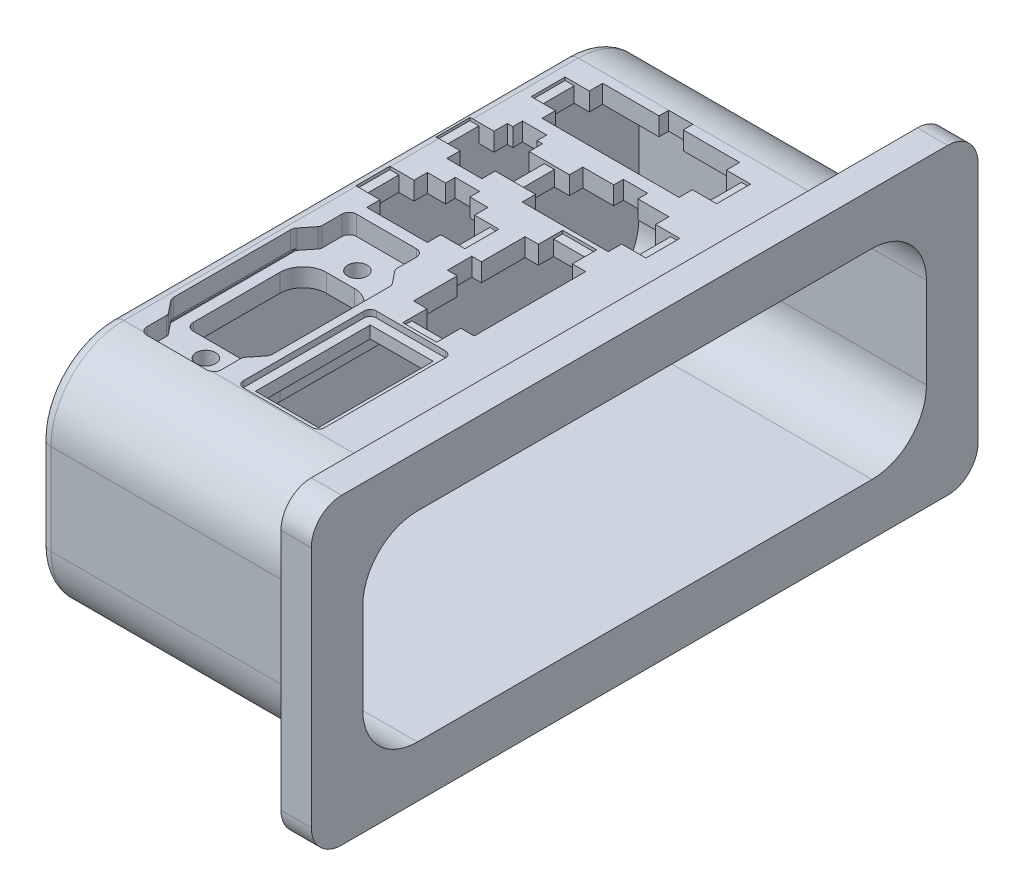
from build123d import *

# Parameters (mm, degrees)
BOSS_EXTRUDE1_DEPTH      = 10.45
BOSS_EXTRUDE2_DEPTH      = 5
CUT_EXTRUDE1_REACH       = 214.842
EXTRUDE_THIN1_DEPTH      = 35
EXTRUDE_THIN1_DEPTH_BACK = 15.45
BOSS_EXTRUDE4_DEPTH      = 3
FILLET1_R                = 2
CUT_EXTRUDE2_REACH       = 421.465
SKETCH16_W               = 30.6
SKETCH16_H               = 5.6
SKETCH16_W_2             = 34.65
SKETCH16_W_3             = 18
SKETCH16_W_4             = 5.6
SKETCH16_H_2             = 26.4
CUT_EXTRUDE3_DEPTH       = 0.5
CUT_EXTRUDE4_DEPTH       = 3
CUT_EXTRUDE5_DEPTH       = 1
SKETCH25_W               = 10.4
SKETCH25_H               = 18.95
CUT_EXTRUDE6_DEPTH       = 420.157757205
BOSS_EXTRUDE6_DEPTH      = 0.2
SKETCH28_R               = 1.6
BOSS_EXTRUDE7_DEPTH      = 3


with BuildPart() as part:
    # Sketch1 → Boss-Extrude1 (new body)
    with BuildSketch(Plane.ZY.offset(330.42)):
        with BuildLine():
            Line((-96.595, 35.5), (-96.595, 50.5))
            ThreePointArc((-96.595, 50.5), (-100.109718626, 58.985281374), (-108.595, 62.5))
            Line((-108.595, 62.5), (-183.595, 62.5))
            ThreePointArc((-183.595, 62.5), (-192.080281374, 58.985281374), (-195.595, 50.5))
            Line((-195.595, 50.5), (-195.595, 35.5))
            ThreePointArc((-195.595, 35.5), (-192.080281374, 27.014718626), (-183.595, 23.5))
            Line((-183.595, 23.5), (-108.595, 23.5))
            ThreePointArc((-108.595, 23.5), (-100.109718626, 27.014718626), (-96.595, 35.5))
        make_face()
    extrude(amount=-BOSS_EXTRUDE1_DEPTH)

    # Sketch2 → Boss-Extrude2 (add)
    with BuildSketch(Plane(origin=(-319.97, 0, 0), x_dir=(0, 0, -1), z_dir=(1, 0, 0))):
        with BuildLine():
            Line((51.095, 23), (51.095, 63))
            ThreePointArc((51.095, 63), (49.630533906, 66.535533906), (46.095, 68))
            Line((46.095, 68), (-53.905, 68))
            ThreePointArc((-53.905, 68), (-57.440533906, 66.535533906), (-58.905, 63))
            Line((-58.905, 63), (-58.905, 23))
            ThreePointArc((-58.905, 23), (-57.440533906, 19.464466094), (-53.905, 18))
            Line((-53.905, 18), (46.095, 18))
            ThreePointArc((46.095, 18), (49.630533906, 19.464466094), (51.095, 23))
        make_face()
        with BuildLine():
            Line((201.095, 23), (201.095, 63))
            ThreePointArc((201.095, 63), (199.630533906, 66.535533906), (196.095, 68))
            Line((196.095, 68), (96.095, 68))
            ThreePointArc((96.095, 68), (92.559466094, 66.535533906), (91.095, 63))
            Line((91.095, 63), (91.095, 23))
            ThreePointArc((91.095, 23), (92.559466094, 19.464466094), (96.095, 18))
            Line((96.095, 18), (196.095, 18))
            ThreePointArc((196.095, 18), (199.630533906, 19.464466094), (201.095, 23))
        make_face()
        with BuildLine():
            Line((-98.905, 23), (-98.905, 63))
            ThreePointArc((-98.905, 63), (-100.369466094, 66.535533906), (-103.905, 68))
            Line((-103.905, 68), (-203.905, 68))
            ThreePointArc((-203.905, 68), (-207.440533906, 66.535533906), (-208.905, 63))
            Line((-208.905, 63), (-208.905, 23))
            ThreePointArc((-208.905, 23), (-207.440533906, 19.464466094), (-203.905, 18))
            Line((-203.905, 18), (-103.905, 18))
            ThreePointArc((-103.905, 18), (-100.369466094, 19.464466094), (-98.905, 23))
        make_face()
    extrude(amount=BOSS_EXTRUDE2_DEPTH)


with BuildPart() as boss_extrude2_piece_1:
    # of the separate pieces the step leaves, piece 1, a body of its own (boss_extrude2_pieces)
    add(part.part.solids().sort_by_distance((-319.97, 23, -201.095))[0])

    # Sketch10 → Cut-Extrude1 (cut, up to next)
    with BuildSketch(Plane(origin=(-314.97, 0, 0), x_dir=(0, 0, -1), z_dir=(1, 0, 0)), mode=Mode.PRIVATE) as cut_extrude1_sk1:
        with BuildLine():
            Line((183.595, 62.5), (108.595, 62.5))
            ThreePointArc((108.595, 62.5), (100.109718626, 58.985281374), (96.595, 50.5))
            Line((96.595, 50.5), (96.595, 35.5))
            ThreePointArc((96.595, 35.5), (100.109718626, 27.014718626), (108.595, 23.5))
            Line((108.595, 23.5), (183.595, 23.5))
            ThreePointArc((183.595, 23.5), (192.080281374, 27.014718626), (195.595, 35.5))
            Line((195.595, 35.5), (195.595, 50.5))
            ThreePointArc((195.595, 50.5), (192.080281374, 58.985281374), (183.595, 62.5))
        make_face()
    cut_extrude1_tool1 = extrude(cut_extrude1_sk1.sketch, amount=-CUT_EXTRUDE1_REACH, mode=Mode.PRIVATE) & boss_extrude2_piece_1.part
    add(cut_extrude1_tool1.solids().sort_by_distance((-314.97, 43, -146.095))[0], mode=Mode.SUBTRACT)

    # Sketch1<3> → Extrude-Thin1 (add, two sides: drawn at the far end of the back side and taken through both)
    with BuildSketch(Plane.ZY.offset(330.42).offset(-EXTRUDE_THIN1_DEPTH_BACK)):
        with BuildLine():
            Line((-195.595, 50.5), (-195.595, 35.5))
            ThreePointArc((-195.595, 35.5), (-192.080281374, 27.014718626), (-183.595, 23.5))
            Line((-183.595, 23.5), (-108.595, 23.5))
            ThreePointArc((-108.595, 23.5), (-100.109718626, 27.014718626), (-96.595, 35.5))
            Line((-96.595, 35.5), (-96.595, 50.5))
            ThreePointArc((-96.595, 50.5), (-100.109718626, 58.985281374), (-108.595, 62.5))
            Line((-108.595, 62.5), (-183.595, 62.5))
            ThreePointArc((-183.595, 62.5), (-192.080281374, 58.985281374), (-195.595, 50.5))
        make_face()
        with BuildLine():
            Line((-192.595, 50.5), (-192.595, 35.5))
            ThreePointArc((-192.595, 35.5), (-189.958961031, 29.136038969), (-183.595, 26.5))
            Line((-183.595, 26.5), (-108.595, 26.5))
            ThreePointArc((-108.595, 26.5), (-102.231038969, 29.136038969), (-99.595, 35.5))
            Line((-99.595, 35.5), (-99.595, 50.5))
            ThreePointArc((-99.595, 50.5), (-102.231038969, 56.863961031), (-108.595, 59.5))
            Line((-108.595, 59.5), (-183.595, 59.5))
            ThreePointArc((-183.595, 59.5), (-189.958961031, 56.863961031), (-192.595, 50.5))
        make_face(mode=Mode.SUBTRACT)
    extrude(amount=EXTRUDE_THIN1_DEPTH + EXTRUDE_THIN1_DEPTH_BACK)

    # Sketch15 → Boss-Extrude4 (add)
    with BuildSketch(Plane.ZY.offset(365.42)):
        with BuildLine():
            Line((-108.595, 62.5), (-183.595, 62.5))
            ThreePointArc((-183.595, 62.5), (-192.080281374, 58.985281374), (-195.595, 50.5))
            Line((-195.595, 50.5), (-195.595, 35.5))
            ThreePointArc((-195.595, 35.5), (-192.080281374, 27.014718626), (-183.595, 23.5))
            Line((-183.595, 23.5), (-108.595, 23.5))
            ThreePointArc((-108.595, 23.5), (-100.109718626, 27.014718626), (-96.595, 35.5))
            Line((-96.595, 35.5), (-96.595, 50.5))
            ThreePointArc((-96.595, 50.5), (-100.109718626, 58.985281374), (-108.595, 62.5))
        make_face()
    extrude(amount=-BOSS_EXTRUDE4_DEPTH)

    # Fillet1
    fillet1_edges = [boss_extrude2_piece_1.edges().sort_by_distance(p)[0] for p in [
        (-365.42, 58.985281374, -100.109718626),
        (-365.42, 62.5, -146.095),
        (-365.42, 58.985281374, -192.080281374),
        (-365.42, 43, -195.595),
        (-365.42, 27.014718626, -192.080281374),
        (-365.42, 23.5, -146.095),
        (-365.42, 27.014718626, -100.109718626),
        (-365.42, 43, -96.595),
    ]]
    fillet(fillet1_edges, radius=FILLET1_R)

    # Sketch13 → Cut-Extrude2 (cut, up to next)
    with BuildSketch(Plane(origin=(0, 62.5, 0), x_dir=(1, 0, 0), z_dir=(0, 1, 0)), mode=Mode.PRIVATE) as cut_extrude2_sk1:
        Polygon((-344.495, 181.995), (-335.195, 181.995), (-335.195, 179.795), (-332.695, 179.795), (-332.695, 174.195), (-335.195, 174.195), (-335.195, 171.995), (-357.795, 171.995), (-357.795, 174.195), (-360.295, 174.195), (-360.295, 179.795), (-357.795, 179.795), (-357.795, 181.995), (-348.495, 181.995), (-348.495, 183.595), (-344.495, 183.595), align=None)
    cut_extrude2_tool1 = extrude(cut_extrude2_sk1.sketch, amount=-CUT_EXTRUDE2_REACH, mode=Mode.PRIVATE) & boss_extrude2_piece_1.part
    # Sketch13 → Cut-Extrude2 (cut, up to next)
    with BuildSketch(Plane(origin=(0, 62.5, 0), x_dir=(1, 0, 0), z_dir=(0, 1, 0)), mode=Mode.PRIVATE) as cut_extrude2_sk2:
        Polygon((-359.92, 168.395), (-359.02, 168.395), (-359.02, 169.995), (-355.02, 169.995), (-355.02, 168.395), (-354.12, 168.395), (-354.12, 166.195), (-351.62, 166.195), (-351.62, 160.595), (-354.12, 160.595), (-354.12, 158.395), (-359.92, 158.395), (-359.92, 160.595), (-362.42, 160.595), (-362.42, 166.195), (-359.92, 166.195), align=None)
    cut_extrude2_tool2 = extrude(cut_extrude2_sk2.sketch, amount=-CUT_EXTRUDE2_REACH, mode=Mode.PRIVATE) & boss_extrude2_piece_1.part
    # Sketch13 → Cut-Extrude2 (cut, up to next)
    with BuildSketch(Plane(origin=(0, 62.5, 0), x_dir=(1, 0, 0), z_dir=(0, 1, 0)), mode=Mode.PRIVATE) as cut_extrude2_sk3:
        Polygon((-342.295, 135.295), (-342.295, 142.495), (-343.895, 142.495), (-343.895, 146.495), (-342.295, 146.495), (-342.295, 153.695), (-340.095, 153.695), (-340.095, 156.195), (-334.495, 156.195), (-334.495, 153.695), (-332.295, 153.695), (-332.295, 135.295), (-334.495, 135.295), (-334.495, 132.795), (-340.095, 132.795), (-340.095, 135.295), align=None)
    cut_extrude2_tool3 = extrude(cut_extrude2_sk3.sketch, amount=-CUT_EXTRUDE2_REACH, mode=Mode.PRIVATE) & boss_extrude2_piece_1.part
    # Sketch13 → Cut-Extrude2 (cut, up to next)
    with BuildSketch(Plane(origin=(0, 62.5, 0), x_dir=(1, 0, 0), z_dir=(0, 1, 0)), mode=Mode.PRIVATE) as cut_extrude2_sk4:
        Polygon((-359.52, 154.795), (-356.52, 154.795), (-356.52, 156.395), (-352.52, 156.395), (-352.52, 154.795), (-349.52, 154.795), (-349.52, 152.595), (-347.02, 152.595), (-347.02, 146.995), (-349.52, 146.995), (-349.52, 144.795), (-359.52, 144.795), (-359.52, 146.995), (-362.02, 146.995), (-362.02, 152.595), (-359.52, 152.595), align=None)
    cut_extrude2_tool4 = extrude(cut_extrude2_sk4.sketch, amount=-CUT_EXTRUDE2_REACH, mode=Mode.PRIVATE) & boss_extrude2_piece_1.part
    # Sketch13 → Cut-Extrude2 (cut, up to next)
    with BuildSketch(Plane(origin=(0, 62.5, 0), x_dir=(1, 0, 0), z_dir=(0, 1, 0)), mode=Mode.PRIVATE) as cut_extrude2_sk5:
        Polygon((-347.47, 168.395), (-342.37, 168.395), (-342.37, 169.995), (-338.37, 169.995), (-338.37, 168.395), (-333.27, 168.395), (-333.27, 166.195), (-330.77, 166.195), (-330.77, 160.595), (-333.27, 160.595), (-333.27, 158.395), (-347.47, 158.395), (-347.47, 160.595), (-349.97, 160.595), (-349.97, 166.195), (-347.47, 166.195), align=None)
    cut_extrude2_tool5 = extrude(cut_extrude2_sk5.sketch, amount=-CUT_EXTRUDE2_REACH, mode=Mode.PRIVATE) & boss_extrude2_piece_1.part
    add(cut_extrude2_tool1.solids().sort_by_distance((-346.495, 62.5, -177.13755))[0], mode=Mode.SUBTRACT)
    add(cut_extrude2_tool2.solids().sort_by_distance((-357.02, 62.5, -163.796732))[0], mode=Mode.SUBTRACT)
    add(cut_extrude2_tool3.solids().sort_by_distance((-337.464963, 62.5, -144.495))[0], mode=Mode.SUBTRACT)
    add(cut_extrude2_tool4.solids().sort_by_distance((-354.52, 62.5, -150.07119))[0], mode=Mode.SUBTRACT)
    add(cut_extrude2_tool5.solids().sort_by_distance((-340.37, 62.5, -163.605431))[0], mode=Mode.SUBTRACT)

    # Sketch16 → Cut-Extrude3 (cut)
    with BuildSketch(Plane(origin=(0, 62.5, 0), x_dir=(1, 0, 0), z_dir=(0, 1, 0))):
        with Locations((-346.495, 176.995)):
            Rectangle(SKETCH16_W, SKETCH16_H)
        with Locations((-346.595, 163.395)):
            Rectangle(SKETCH16_W_2, SKETCH16_H)
        with Locations((-354.52, 149.795)):
            Rectangle(SKETCH16_W_3, SKETCH16_H)
        with Locations((-337.295, 144.495)):
            Rectangle(SKETCH16_W_4, SKETCH16_H_2)
    extrude(amount=-CUT_EXTRUDE3_DEPTH, mode=Mode.SUBTRACT)

    # Sketch21 → Cut-Extrude4 (cut)
    with BuildSketch(Plane(origin=(0, 62.5, 0), x_dir=(1, 0, 0), z_dir=(0, 1, 0))):
        with BuildLine():
            Line((-360.795304952, 138.046025021), (-362.357042571, 136.093852998))
            ThreePointArc((-362.357042571, 136.093852998), (-362.552353983, 135.74142727), (-362.62, 135.344218941))
            Line((-362.62, 135.344218941), (-362.62, 116.045781059))
            ThreePointArc((-362.62, 116.045781059), (-362.552353983, 115.64857273), (-362.357042571, 115.296147002))
            Line((-362.357042571, 115.296147002), (-360.795304952, 113.343974979))
            ThreePointArc((-360.795304952, 113.343974979), (-360.665097345, 113.109024494), (-360.62, 112.844218941))
            Line((-360.62, 112.844218941), (-360.62, 109.595))
            ThreePointArc((-360.62, 109.595), (-360.268528137, 108.746471863), (-359.42, 108.395))
            Line((-359.42, 108.395), (-349.52, 108.395))
            ThreePointArc((-349.52, 108.395), (-348.671471863, 108.746471863), (-348.32, 109.595))
            Line((-348.32, 109.595), (-348.32, 112.844218941))
            ThreePointArc((-348.32, 112.844218941), (-348.274902655, 113.109024494), (-348.144695048, 113.343974979))
            Line((-348.144695048, 113.343974979), (-346.582957429, 115.296147002))
            ThreePointArc((-346.582957429, 115.296147002), (-346.387646017, 115.64857273), (-346.32, 116.045781059))
            Line((-346.32, 116.045781059), (-346.32, 135.344218941))
            ThreePointArc((-346.32, 135.344218941), (-346.387646017, 135.74142727), (-346.582957429, 136.093852998))
            Line((-346.582957429, 136.093852998), (-348.144695048, 138.046025021))
            ThreePointArc((-348.144695048, 138.046025021), (-348.274902655, 138.280975506), (-348.32, 138.545781059))
            Line((-348.32, 138.545781059), (-348.32, 141.795))
            ThreePointArc((-348.32, 141.795), (-348.671471863, 142.643528137), (-349.52, 142.995))
            Line((-349.52, 142.995), (-359.42, 142.995))
            ThreePointArc((-359.42, 142.995), (-360.268528137, 142.643528137), (-360.62, 141.795))
            Line((-360.62, 141.795), (-360.62, 138.545781059))
            ThreePointArc((-360.62, 138.545781059), (-360.665097345, 138.280975506), (-360.795304952, 138.046025021))
        make_face()
    extrude(amount=-CUT_EXTRUDE4_DEPTH, mode=Mode.SUBTRACT)

    # Sketch24 → Cut-Extrude5 (cut)
    with BuildSketch(Plane(origin=(0, 62.5, 0), x_dir=(1, 0, 0), z_dir=(0, 1, 0))):
        with BuildLine():
            Line((-343.945, 130.795), (-332.545, 130.795))
            ThreePointArc((-332.545, 130.795), (-331.837893219, 130.502106781), (-331.545, 129.795))
            Line((-331.545, 129.795), (-331.545, 109.845))
            ThreePointArc((-331.545, 109.845), (-331.837893219, 109.137893219), (-332.545, 108.845))
            Line((-332.545, 108.845), (-343.945, 108.845))
            ThreePointArc((-343.945, 108.845), (-344.652106781, 109.137893219), (-344.945, 109.845))
            Line((-344.945, 109.845), (-344.945, 129.795))
            ThreePointArc((-344.945, 129.795), (-344.652106781, 130.502106781), (-343.945, 130.795))
        make_face()
    extrude(amount=-CUT_EXTRUDE5_DEPTH, mode=Mode.SUBTRACT)

    # Sketch25 → Cut-Extrude6 (cut, through all)
    with BuildSketch(Plane.XZ.offset(-59.5)):
        with Locations((-338.245, -119.82)):
            Rectangle(SKETCH25_W, SKETCH25_H)
    extrude(amount=-CUT_EXTRUDE6_DEPTH, mode=Mode.SUBTRACT)

    # Sketch27 → Boss-Extrude6 (add)
    with BuildSketch(Plane.XZ.offset(-59.5)):
        with BuildLine():
            ThreePointArc((-349.52, -144.195), (-347.822943725, -143.492056275), (-347.12, -141.795))
            Line((-347.12, -141.795), (-347.12, -138.686093483))
            Line((-347.12, -138.686093483), (-345.645914857, -136.843487055))
            ThreePointArc((-345.645914857, -136.843487055), (-345.255292034, -136.1386356), (-345.12, -135.344218941))
            Line((-345.12, -135.344218941), (-345.12, -116.045781059))
            ThreePointArc((-345.12, -116.045781059), (-345.255292034, -115.2513644), (-345.645914857, -114.546512945))
            Line((-345.645914857, -114.546512945), (-347.12, -112.703906517))
            Line((-347.12, -112.703906517), (-347.12, -109.595))
            ThreePointArc((-347.12, -109.595), (-347.822943725, -107.897943725), (-349.52, -107.195))
            Line((-349.52, -107.195), (-359.42, -107.195))
            Line((-359.42, -107.195), (-363.42, -107.195))
            Line((-363.42, -107.195), (-363.42, -144.195))
            Line((-363.42, -144.195), (-359.42, -144.195))
            Line((-359.42, -144.195), (-349.52, -144.195))
        make_face()
        with BuildLine():
            Line((-348.32, -138.545781059), (-348.32, -141.795))
            ThreePointArc((-348.32, -141.795), (-348.671471863, -142.643528137), (-349.52, -142.995))
            Line((-349.52, -142.995), (-359.42, -142.995))
            ThreePointArc((-359.42, -142.995), (-360.268528137, -142.643528137), (-360.62, -141.795))
            Line((-360.62, -141.795), (-360.62, -138.545781059))
            ThreePointArc((-360.62, -138.545781059), (-360.665097345, -138.280975506), (-360.795304952, -138.046025021))
            Line((-360.795304952, -138.046025021), (-362.357042571, -136.093852998))
            ThreePointArc((-362.357042571, -136.093852998), (-362.552353983, -135.74142727), (-362.62, -135.344218941))
            Line((-362.62, -135.344218941), (-362.62, -116.045781059))
            ThreePointArc((-362.62, -116.045781059), (-362.568912529, -115.699370898), (-362.42, -115.382456101))
            Line((-362.42, -115.382456101), (-362.42, -108.595))
            Line((-362.42, -108.595), (-360.083324958, -108.595))
            ThreePointArc((-360.083324958, -108.595), (-359.766410162, -108.446087471), (-359.42, -108.395))
            Line((-359.42, -108.395), (-349.52, -108.395))
            ThreePointArc((-349.52, -108.395), (-348.671471863, -108.746471863), (-348.32, -109.595))
            Line((-348.32, -109.595), (-348.32, -112.844218941))
            ThreePointArc((-348.32, -112.844218941), (-348.274902655, -113.109024494), (-348.144695048, -113.343974979))
            Line((-348.144695048, -113.343974979), (-346.582957429, -115.296147002))
            ThreePointArc((-346.582957429, -115.296147002), (-346.387646017, -115.64857273), (-346.32, -116.045781059))
            Line((-346.32, -116.045781059), (-346.32, -135.344218941))
            ThreePointArc((-346.32, -135.344218941), (-346.387646017, -135.74142727), (-346.582957429, -136.093852998))
            Line((-346.582957429, -136.093852998), (-348.144695048, -138.046025021))
            ThreePointArc((-348.144695048, -138.046025021), (-348.274902655, -138.280975506), (-348.32, -138.545781059))
        make_face(mode=Mode.SUBTRACT)
    extrude(amount=BOSS_EXTRUDE6_DEPTH)

    # Sketch28 → Boss-Extrude7 (add)
    with BuildSketch(Plane.XZ.offset(-59.3)):
        with BuildLine():
            Line((-359.42, -144.195), (-349.52, -144.195))
            ThreePointArc((-349.52, -144.195), (-347.822943725, -143.492056275), (-347.12, -141.795))
            Line((-347.12, -141.795), (-347.12, -138.686093483))
            Line((-347.12, -138.686093483), (-345.645914857, -136.843487055))
            ThreePointArc((-345.645914857, -136.843487055), (-345.255292034, -136.1386356), (-345.12, -135.344218941))
            Line((-345.12, -135.344218941), (-345.12, -116.045781059))
            ThreePointArc((-345.12, -116.045781059), (-345.255292034, -115.2513644), (-345.645914857, -114.546512945))
            Line((-345.645914857, -114.546512945), (-347.12, -112.703906517))
            Line((-347.12, -112.703906517), (-347.12, -109.595))
            ThreePointArc((-347.12, -109.595), (-347.822943725, -107.897943725), (-349.52, -107.195))
            Line((-349.52, -107.195), (-359.42, -107.195))
            Line((-359.42, -107.195), (-363.42, -107.195))
            Line((-363.42, -107.195), (-363.42, -144.195))
            Line((-363.42, -144.195), (-359.42, -144.195))
        make_face()
        with Locations(Location((-354.47, -138.195, 0), (0, 0, 270))):
            Circle(SKETCH28_R, mode=Mode.SUBTRACT)
        with Locations(Location((-354.47, -113.195, 0), (0, 0, 270))):
            Circle(SKETCH28_R, mode=Mode.SUBTRACT)
        with BuildLine():
            Line((-352.145, -135.395), (-356.795, -135.395))
            ThreePointArc((-356.795, -135.395), (-359.499683438, -134.274683438), (-360.62, -131.57))
            Line((-360.62, -131.57), (-360.62, -117.295))
            ThreePointArc((-360.62, -117.295), (-360.239238815, -116.375761184), (-359.32, -115.995))
            Line((-359.32, -115.995), (-349.62, -115.995))
            ThreePointArc((-349.62, -115.995), (-348.700761184, -116.375761184), (-348.32, -117.295))
            Line((-348.32, -117.295), (-348.32, -131.57))
            ThreePointArc((-348.32, -131.57), (-349.440316562, -134.274683438), (-352.145, -135.395))
        make_face(mode=Mode.SUBTRACT)
    extrude(amount=BOSS_EXTRUDE7_DEPTH)


with BuildPart() as boss_extrude2_piece_2:
    # of the separate pieces the step leaves, piece 2, a body of its own (boss_extrude2_pieces)
    add(part.part.solids().sort_by_distance((-319.97, 18, 53.905))[0])


with BuildPart() as boss_extrude2_piece_3:
    # of the separate pieces the step leaves, piece 3, a body of its own (boss_extrude2_pieces)
    add(part.part.solids().sort_by_distance((-319.97, 18, 203.905))[0])


solid = boss_extrude2_piece_1.part
